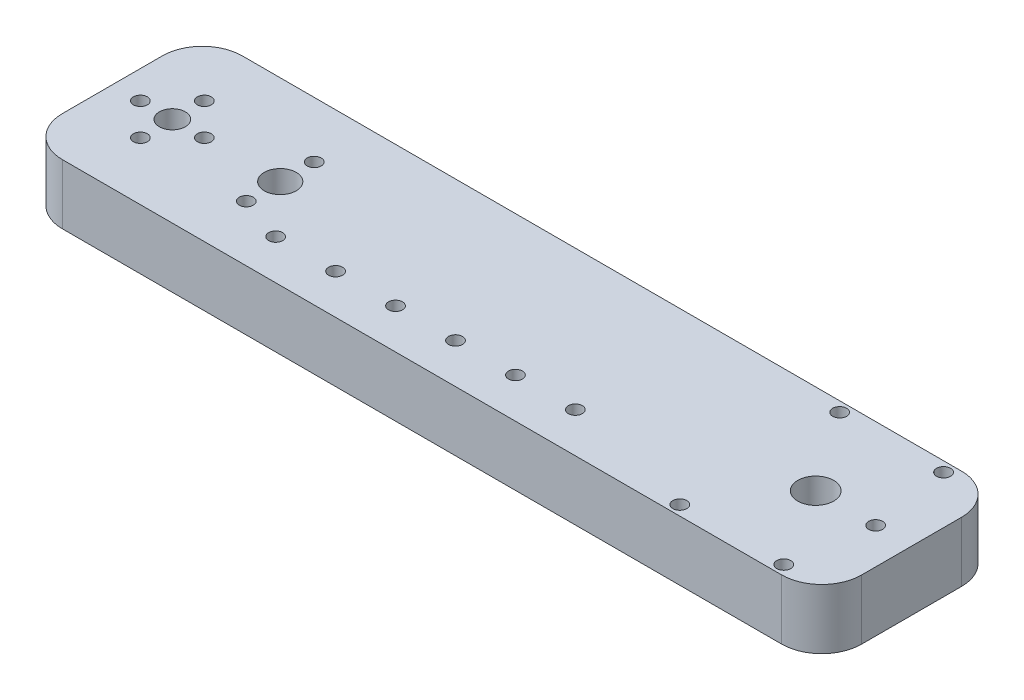
from build123d import *

# Parameters (mm, degrees)
CROQUIS1_W              = 200
CROQUIS1_H              = 45
SALIENTE_EXTRUIR1_DEPTH = 10
CORTAR_EXTRUIR1_REACH   = 104.987
CROQUIS2_R              = 3.25
CORTAR_EXTRUIR2_REACH   = 104.987
CROQUIS4_R              = 4.5
CORTAR_EXTRUIR3_REACH   = 104.987
CROQUIS6_R              = 1.75
CORTAR_EXTRUIR4_REACH   = 104.987
CROQUIS7_R              = 4
CROQUIS7_R_2            = 1.75
CROQUIS9_W              = 200
CROQUIS9_H              = 45
CROQUIS9_W_2            = 194
CROQUIS9_H_2            = 35
SALIENTE_EXTRUIR2_DEPTH = 5
REDONDEO1_R             = 10
REDONDEO2_R             = 10
CROQUIS10_R             = 1.75
CORTAR_EXTRUIR5_DEPTH   = 15
CROQUIS11_R             = 9.5
CROQUIS11_R_2           = 8
SALIENTE_EXTRUIR3_DEPTH = 4
REDONDEO3_R             = 3
CORTAR_EXTRUIR6_REACH   = 105.592
CROQUIS12_R             = 1.75
CROQUIS13_R             = 1.75
CORTAR_EXTRUIR7_DEPTH   = 10


with BuildPart() as part:
    # Croquis1 → Saliente-Extruir1 (new body)
    with BuildSketch(Plane(origin=(0, 0, 0), x_dir=(1, 0, 0), z_dir=(0, 1, 0))):
        Rectangle(CROQUIS1_W, CROQUIS1_H)
    extrude(amount=SALIENTE_EXTRUIR1_DEPTH)

    # Croquis2 → Cortar-Extruir1 (cut, up to next)
    with BuildSketch(Plane.XZ, mode=Mode.PRIVATE) as cortar_extruir1_sk1:
        with Locations(Location((-85, 0, 0), (0, 0, 270))):
            Circle(CROQUIS2_R)
    cortar_extruir1_tool1 = extrude(cortar_extruir1_sk1.sketch, amount=-CORTAR_EXTRUIR1_REACH, mode=Mode.PRIVATE) & part.part
    add(cortar_extruir1_tool1.solids().sort_by_distance((-85, 0, 0))[0], mode=Mode.SUBTRACT)

    # Croquis4 → Cortar-Extruir2 (cut, up to next)
    with BuildSketch(Plane(origin=(0, 10, 0), x_dir=(1, 0, 0), z_dir=(0, 1, 0)), mode=Mode.PRIVATE) as cortar_extruir2_sk1:
        with Locations(Location((76, 0, 0), (0, 0, 270))):
            Circle(CROQUIS4_R)
    cortar_extruir2_tool1 = extrude(cortar_extruir2_sk1.sketch, amount=-CORTAR_EXTRUIR2_REACH, mode=Mode.PRIVATE) & part.part
    add(cortar_extruir2_tool1.solids().sort_by_distance((76, 10, 0))[0], mode=Mode.SUBTRACT)

    # Croquis6 → Cortar-Extruir3 (cut, up to next)
    with BuildSketch(Plane.XZ, mode=Mode.PRIVATE) as cortar_extruir3_sk1:
        with Locations(Location((-77, 0, 0), (0, 0, 270))):
            Circle(CROQUIS6_R)
    cortar_extruir3_tool1 = extrude(cortar_extruir3_sk1.sketch, amount=-CORTAR_EXTRUIR3_REACH, mode=Mode.PRIVATE) & part.part
    # Croquis6 → Cortar-Extruir3 (cut, up to next)
    with BuildSketch(Plane.XZ, mode=Mode.PRIVATE) as cortar_extruir3_sk2:
        with Locations(Location((-93, 0, 0), (0, 0, 270))):
            Circle(CROQUIS6_R)
    cortar_extruir3_tool2 = extrude(cortar_extruir3_sk2.sketch, amount=-CORTAR_EXTRUIR3_REACH, mode=Mode.PRIVATE) & part.part
    # Croquis6 → Cortar-Extruir3 (cut, up to next)
    with BuildSketch(Plane.XZ, mode=Mode.PRIVATE) as cortar_extruir3_sk3:
        with Locations(Location((-85, 8, 0), (0, 0, 270))):
            Circle(CROQUIS6_R)
    cortar_extruir3_tool3 = extrude(cortar_extruir3_sk3.sketch, amount=-CORTAR_EXTRUIR3_REACH, mode=Mode.PRIVATE) & part.part
    # Croquis6 → Cortar-Extruir3 (cut, up to next)
    with BuildSketch(Plane.XZ, mode=Mode.PRIVATE) as cortar_extruir3_sk4:
        with Locations(Location((-85, -8, 0), (0, 0, 270))):
            Circle(CROQUIS6_R)
    cortar_extruir3_tool4 = extrude(cortar_extruir3_sk4.sketch, amount=-CORTAR_EXTRUIR3_REACH, mode=Mode.PRIVATE) & part.part
    add(cortar_extruir3_tool1.solids().sort_by_distance((-77, 0, 0))[0], mode=Mode.SUBTRACT)
    add(cortar_extruir3_tool2.solids().sort_by_distance((-93, 0, 0))[0], mode=Mode.SUBTRACT)
    add(cortar_extruir3_tool3.solids().sort_by_distance((-85, 0, 8))[0], mode=Mode.SUBTRACT)
    add(cortar_extruir3_tool4.solids().sort_by_distance((-85, 0, -8))[0], mode=Mode.SUBTRACT)

    # Croquis7 → Cortar-Extruir4 (cut, up to next)
    with BuildSketch(Plane.XZ, mode=Mode.PRIVATE) as cortar_extruir4_sk1:
        with Locations(Location((-58, 0, 0), (0, 0, 270))):
            Circle(CROQUIS7_R)
    cortar_extruir4_tool1 = extrude(cortar_extruir4_sk1.sketch, amount=-CORTAR_EXTRUIR4_REACH, mode=Mode.PRIVATE) & part.part
    # Croquis7 → Cortar-Extruir4 (cut, up to next)
    with BuildSketch(Plane.XZ, mode=Mode.PRIVATE) as cortar_extruir4_sk2:
        with Locations(Location((-58, 8.5, 0), (0, 0, 270))):
            Circle(CROQUIS7_R_2)
    cortar_extruir4_tool2 = extrude(cortar_extruir4_sk2.sketch, amount=-CORTAR_EXTRUIR4_REACH, mode=Mode.PRIVATE) & part.part
    # Croquis7 → Cortar-Extruir4 (cut, up to next)
    with BuildSketch(Plane.XZ, mode=Mode.PRIVATE) as cortar_extruir4_sk3:
        with Locations(Location((-58, -8.5, 0), (0, 0, 270))):
            Circle(CROQUIS7_R_2)
    cortar_extruir4_tool3 = extrude(cortar_extruir4_sk3.sketch, amount=-CORTAR_EXTRUIR4_REACH, mode=Mode.PRIVATE) & part.part
    add(cortar_extruir4_tool1.solids().sort_by_distance((-58, 0, 0))[0], mode=Mode.SUBTRACT)
    add(cortar_extruir4_tool2.solids().sort_by_distance((-58, 0, 8.5))[0], mode=Mode.SUBTRACT)
    add(cortar_extruir4_tool3.solids().sort_by_distance((-58, 0, -8.5))[0], mode=Mode.SUBTRACT)

    # Croquis9 → Saliente-Extruir2 (add)
    with BuildSketch(Plane.XZ):
        Rectangle(CROQUIS9_W, CROQUIS9_H)
        Rectangle(CROQUIS9_W_2, CROQUIS9_H_2, mode=Mode.SUBTRACT)
    extrude(amount=SALIENTE_EXTRUIR2_DEPTH)

    # Redondeo1
    redondeo1_edges = [part.edges().sort_by_distance(p)[0] for p in [
        (100, 2.5, 22.5),
        (-100, 2.5, 22.5),
        (-100, 2.5, -22.5),
        (100, 2.5, -22.5),
    ]]
    fillet(redondeo1_edges, radius=REDONDEO1_R)

    # Redondeo2
    redondeo2_edges = [part.edges().sort_by_distance(p)[0] for p in [
        (97, -2.5, 17.5),
        (-97, -2.5, 17.5),
        (-97, -2.5, -17.5),
        (97, -2.5, -17.5),
    ]]
    fillet(redondeo2_edges, radius=REDONDEO2_R)

    # Croquis10 → Cortar-Extruir5 (cut)
    with BuildSketch(Plane.XZ.offset(5)):
        with Locations(Location((88, 20, 0), (0, 0, 270))):
            Circle(CROQUIS10_R)
        with Locations(Location((62, 20, 0), (0, 0, 270))):
            Circle(CROQUIS10_R)
        with Locations(Location((62, -20, 0), (0, 0, 270))):
            Circle(CROQUIS10_R)
        with Locations(Location((88, -20, 0), (0, 0, 270))):
            Circle(CROQUIS10_R)
    extrude(amount=-CORTAR_EXTRUIR5_DEPTH, mode=Mode.SUBTRACT)

    # Croquis11 → Saliente-Extruir3 (add)
    with BuildSketch(Plane.XZ):
        with Locations(Location((76, 0, 0), (0, 0, 270))):
            Circle(CROQUIS11_R)
        with Locations(Location((76, 0, 0), (0, 0, 270))):
            Circle(CROQUIS11_R_2, mode=Mode.SUBTRACT)
    extrude(amount=SALIENTE_EXTRUIR3_DEPTH)

    # Redondeo3
    redondeo3_edges = [part.edges().sort_by_distance(p)[0] for p in [
        (76, 0, 9.5),
    ]]
    fillet(redondeo3_edges, radius=REDONDEO3_R)

    # Croquis12 → Cortar-Extruir6 (cut, up to next)
    with BuildSketch(Plane(origin=(0, 10, 0), x_dir=(1, 0, 0), z_dir=(0, 1, 0)), mode=Mode.PRIVATE) as cortar_extruir6_sk1:
        with Locations(Location((91, 0, 0), (0, 0, 270))):
            Circle(CROQUIS12_R)
    cortar_extruir6_tool1 = extrude(cortar_extruir6_sk1.sketch, amount=-CORTAR_EXTRUIR6_REACH, mode=Mode.PRIVATE) & part.part
    add(cortar_extruir6_tool1.solids().sort_by_distance((91, 10, 0))[0], mode=Mode.SUBTRACT)

    # Croquis13 → Cortar-Extruir7 (cut)
    with BuildSketch(Plane(origin=(0, 10, 0), x_dir=(1, 0, 0), z_dir=(0, 1, 0))):
        with Locations(Location((28.353351566, -12.5, 0), (0, 0, 270))):
            Circle(CROQUIS13_R)
        with Locations(Location((13.353351566, -12.5, 0), (0, 0, 270))):
            Circle(CROQUIS13_R)
        with Locations(Location((-1.646648434, -12.5, 0), (0, 0, 270))):
            Circle(CROQUIS13_R)
        with Locations(Location((-16.646648434, -12.5, 0), (0, 0, 270))):
            Circle(CROQUIS13_R)
        with Locations(Location((-31.646648434, -12.5, 0), (0, 0, 270))):
            Circle(CROQUIS13_R)
        with Locations(Location((-46.646648434, -12.5, 0), (0, 0, 270))):
            Circle(CROQUIS13_R)
    extrude(amount=-CORTAR_EXTRUIR7_DEPTH, mode=Mode.SUBTRACT)


solid = part.part
